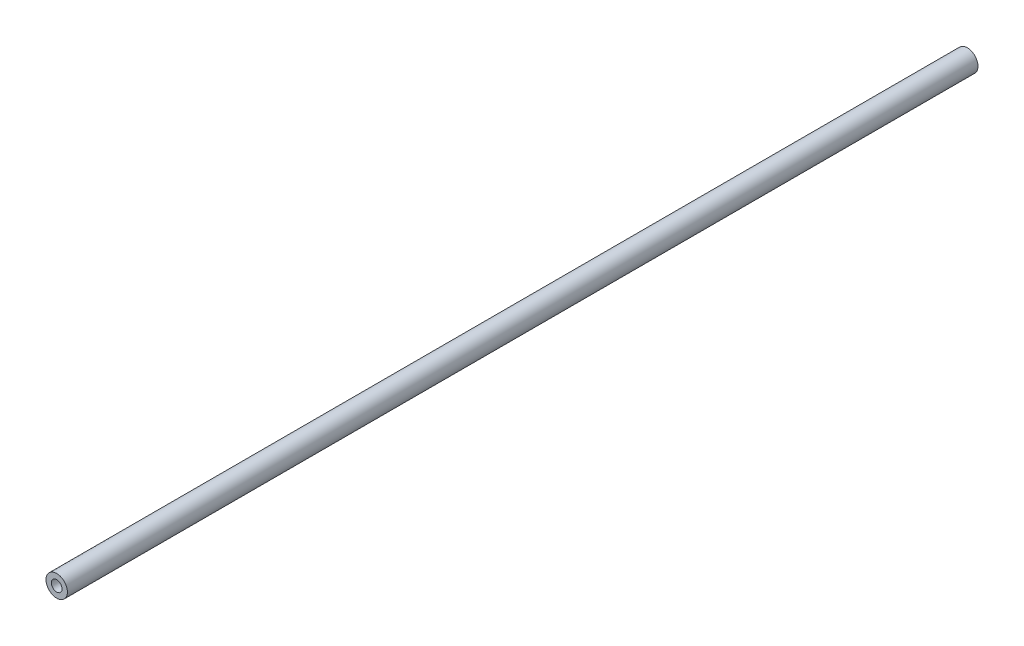
from build123d import *

# Parameters (mm, degrees)
TUBE_START  = -42.5
SKETCH1_R   = 1
SKETCH1_R_2 = 0.5
TUBE_DEPTH  = 85


with BuildPart() as part:
    # Sketch1 → Tube (new body)
    with BuildSketch(Plane.XY.offset(TUBE_START)):
        Circle(SKETCH1_R)
        Circle(SKETCH1_R_2, mode=Mode.SUBTRACT)
    extrude(amount=TUBE_DEPTH)


solid = part.part
